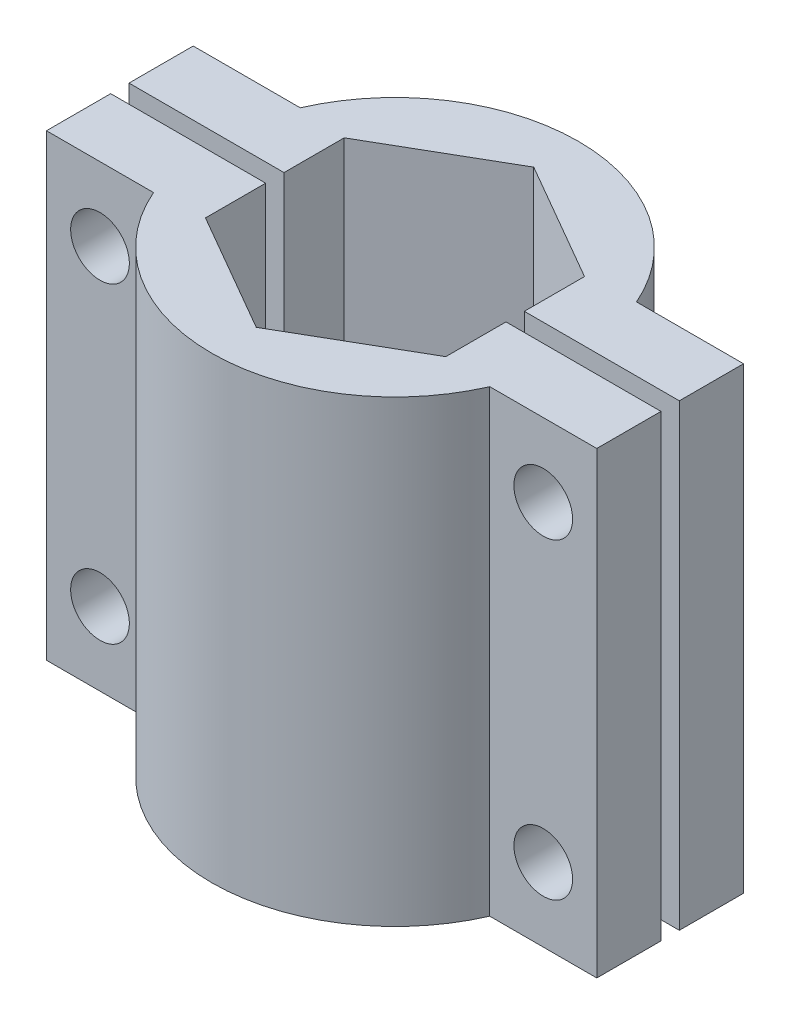
from build123d import *

# Parameters (mm, degrees)
EXTRUDE_1_DEPTH          = 25
CUT_EXTRUDE_1_DEPTH      = 12.5
CUT_EXTRUDE_2_DEPTH      = 12.5
SKETCH_4_W               = 30
SKETCH_4_H               = 1
CUT_EXTRUDE_3_DEPTH      = 31.822070015
CUT_EXTRUDE_4_DEPTH      = 31.822070015
CUT_EXTRUDE_4_DEPTH_BACK = 31.822070015
SKETCH_5_R               = 1.6


with BuildPart() as part:
    # ｽｹｯﾁ1 → ﾎﾞｽ - 押し出し1 (new body)
    with BuildSketch(Plane(origin=(0, 0, 0), x_dir=(1, 0, 0), z_dir=(0, 1, 0))):
        with BuildLine():
            Line((9.16515139, 4), (15, 4))
            Line((15, 4), (15, -4))
            Line((15, -4), (9.16515139, -4))
            ThreePointArc((9.16515139, -4), (0, -10), (-9.16515139, -4))
            Line((-9.16515139, -4), (-15, -4))
            Line((-15, -4), (-15, 4))
            Line((-15, 4), (-9.16515139, 4))
            ThreePointArc((-9.16515139, 4), (0, 10), (9.16515139, 4))
        make_face()
    extrude(amount=EXTRUDE_1_DEPTH)

    # ｽｹｯﾁ2 → ｶｯﾄ - 押し出し1 (cut)
    with BuildSketch(Plane.XZ):
        with BuildLine():
            Line((1.747140521, 2.5), (-1.747140521, 2.5))
            ThreePointArc((-1.747140521, 2.5), (0, -3.05), (1.747140521, 2.5))
        make_face()
    extrude(amount=-CUT_EXTRUDE_1_DEPTH, mode=Mode.SUBTRACT)

    # ｽｹｯﾁ3 → ｶｯﾄ - 押し出し2 (cut)
    with BuildSketch(Plane(origin=(0, 25, 0), x_dir=(1, 0, 0), z_dir=(0, 1, 0))):
        Polygon((0, -7.563288526), (6.55, -3.781644263), (6.55, 3.781644263), (0, 7.563288526), (-6.55, 3.781644263), (-6.55, -3.781644263), align=None)
    extrude(amount=-CUT_EXTRUDE_2_DEPTH, mode=Mode.SUBTRACT)

    # ｽｹｯﾁ4 → ｶｯﾄ - 押し出し3 (cut, through all)
    with BuildSketch(Plane(origin=(0, 0, 0), x_dir=(1, 0, 0), z_dir=(0, 1, 0))):
        Rectangle(SKETCH_4_W, SKETCH_4_H)
    extrude(amount=CUT_EXTRUDE_3_DEPTH, mode=Mode.SUBTRACT)


with BuildPart() as cut_extrude_3_piece_1:
    # of the separate pieces the step leaves, piece 1, a body of its own (cut_extrude_3_pieces)
    add(part.part.solids().sort_by_distance((15, 0, 0.5))[0])


with BuildPart() as cut_extrude_3_piece_2:
    # of the separate pieces the step leaves, piece 2, a body of its own (cut_extrude_3_pieces)
    add(part.part.solids().sort_by_distance((9.16515139, 0, -4))[0])


with BuildPart() as cut_extrude_4_tool:
    # ｽｹｯﾁ5 → ｶｯﾄ - 押し出し4 (new, two sides: drawn at the far end of the back side and taken through both)
    with BuildSketch(Plane.XY.offset(-CUT_EXTRUDE_4_DEPTH_BACK)):
        with Locations((-12.082575695, 21)):
            Circle(SKETCH_5_R)
        with Locations((12.082575695, 21)):
            Circle(SKETCH_5_R)
        with Locations((-12.082575695, 4)):
            Circle(SKETCH_5_R)
        with Locations((12.082575695, 4)):
            Circle(SKETCH_5_R)
    extrude(amount=CUT_EXTRUDE_4_DEPTH + CUT_EXTRUDE_4_DEPTH_BACK)


with BuildPart() as cut_extrude_3_piece_1_1:
    add(cut_extrude_3_piece_1.part)

    # ｶｯﾄ - 押し出し4: cut by cut_extrude_4_tool
    add(cut_extrude_4_tool.part, mode=Mode.SUBTRACT)


with BuildPart() as cut_extrude_3_piece_2_1:
    add(cut_extrude_3_piece_2.part)

    # ｶｯﾄ - 押し出し4: cut by cut_extrude_4_tool
    add(cut_extrude_4_tool.part, mode=Mode.SUBTRACT)


solid = Compound([cut_extrude_3_piece_1_1.part, cut_extrude_3_piece_2_1.part])
